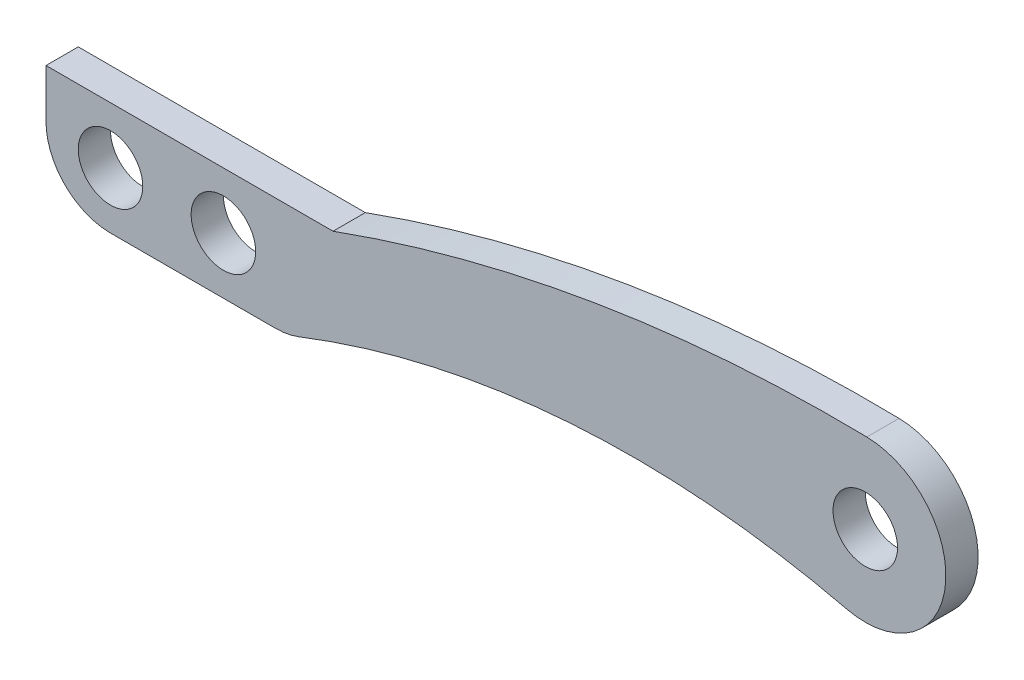
from build123d import *

# Parameters (mm, degrees)
SKETCH1_R           = 2
BOSS_EXTRUDE1_DEPTH = 2
FILLET1_R           = 4


with BuildPart() as part:
    # Sketch1 → Boss-Extrude1 (new body)
    with BuildSketch(Plane.XY):
        with BuildLine():
            Line((-36, 3.5), (-33, 3.5))
            ThreePointArc((-33, 3.5), (-16.705697773, 7.777052757), (0.096212134, 8.999054739))
            ThreePointArc((0.096212134, 8.999054739), (4.959049099, 3.369257867), (-1.158052235, -0.864282903))
            ThreePointArc((-1.158052235, -0.864282903), (-18.684835931, 0.519591906), (-35.800505276, -3.5))
            Line((-35.800505276, -3.5), (-50.800505276, -3.5))
            Line((-50.800505276, -3.5), (-50.800505276, 3.5))
            Line((-50.800505276, 3.5), (-36, 3.5))
        make_face()
        with Locations((-0.001007792, 4)):
            Circle(SKETCH1_R, mode=Mode.SUBTRACT)
        with Locations((-46.800505276, 0)):
            Circle(SKETCH1_R, mode=Mode.SUBTRACT)
        with Locations((-39.800505276, 0)):
            Circle(SKETCH1_R, mode=Mode.SUBTRACT)
    extrude(amount=BOSS_EXTRUDE1_DEPTH)

    # Fillet1
    fillet1_edges = [part.edges().sort_by_distance(p)[0] for p in [
        (-35.800505276, -3.5, 1),
        (-50.800505276, -3.5, 1),
    ]]
    fillet(fillet1_edges, radius=FILLET1_R)


solid = part.part
